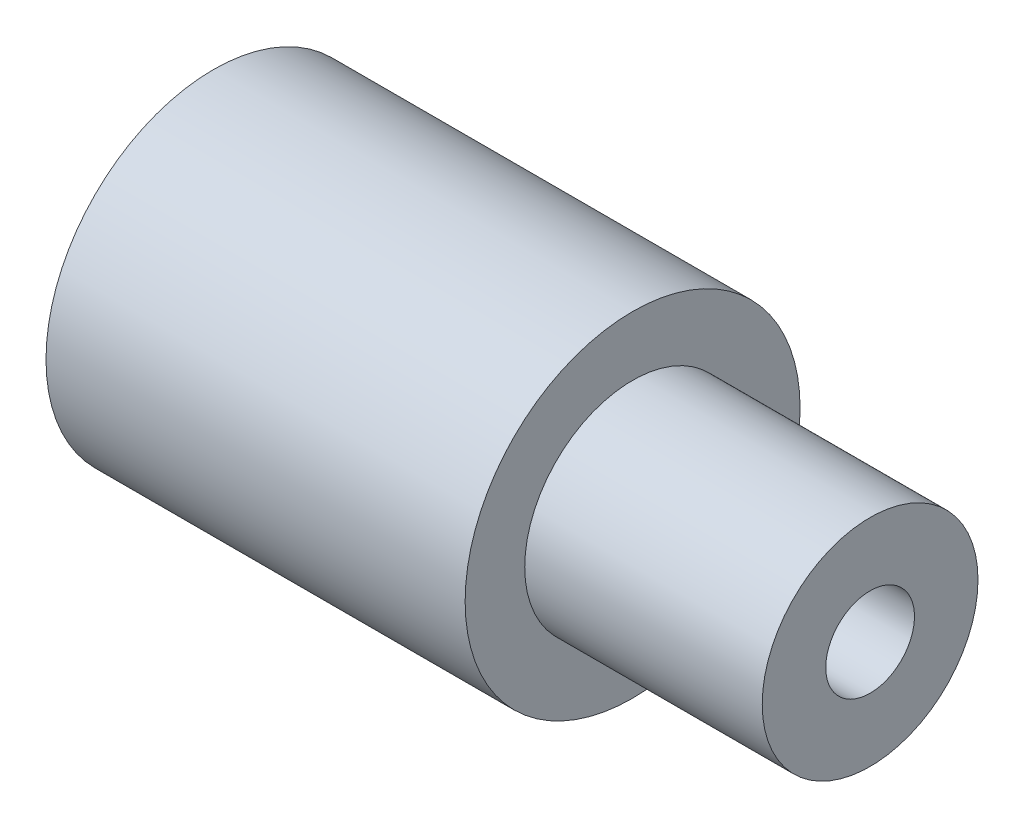
from build123d import *

# Parameters (mm, degrees)
SOCKET_1_SKETCH_W = 23.9
SOCKET_1_SKETCH_H = 6.35
SOCKET_2_SKETCH_W = 16.2
SOCKET_2_SKETCH_H = 3.175


with BuildPart() as part:
    # Reducer_T8_T4 Sketch → Reducer_T8_T4 (revolve)
    with BuildSketch(Plane.XY):
        Polygon((-23.5, 0), (-23.5, 11.988), (0.5, 11.988), (6.5, 11.988), (6.5, 7.722), (23.5, 7.722), (23.5, 0), align=None)
    revolve(axis=Axis((-1000, 0, 0), (1, 0, 0)))

    # Socket 1 Sketch → Socket 1 (revolve, cut)
    with BuildSketch(Plane.XY):
        with Locations((-12.55, 3.175)):
            Rectangle(SOCKET_1_SKETCH_W, SOCKET_1_SKETCH_H)
    revolve(axis=Axis((-1000, 0, 0), (1, 0, 0)), mode=Mode.SUBTRACT)

    # Socket 2 Sketch → Socket 2 (revolve, cut)
    with BuildSketch(Plane.XY):
        with Locations((16.4, 1.5875)):
            Rectangle(SOCKET_2_SKETCH_W, SOCKET_2_SKETCH_H)
    revolve(axis=Axis((-1000, 0, 0), (1, 0, 0)), mode=Mode.SUBTRACT)


solid = part.part
